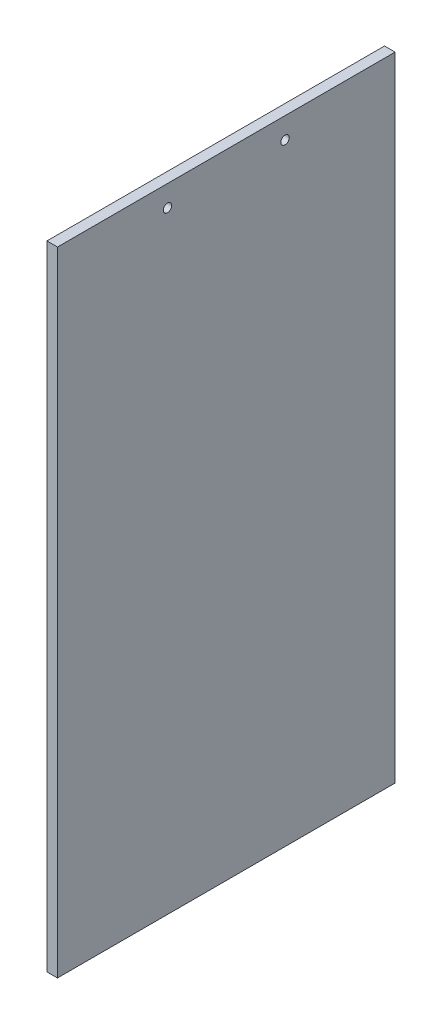
from build123d import *

# Parameters (mm, degrees)
SKETCH_1_W          = 180
SKETCH_1_H          = 300
EXTRUDE_1_DEPTH     = 5
CUT_EXTRUDE_1_REACH = 351.893
SKETCH_2_R          = 2
SKETCH_4_W          = 10
SKETCH_4_H          = 300
CUT_EXTRUDE_3_DEPTH = 10


with BuildPart() as part:
    # 草图1 → 凸台-拉伸1 (new body)
    with BuildSketch(Plane(origin=(0, 0, 0), x_dir=(0, 0, -1), z_dir=(1, 0, 0))):
        with Locations((90, -150)):
            Rectangle(SKETCH_1_W, SKETCH_1_H)
    extrude(amount=EXTRUDE_1_DEPTH)

    # 草图2 → 切除-拉伸1 (cut, up to next)
    with BuildSketch(Plane(origin=(5, 0, 0), x_dir=(0, 0, -1), z_dir=(1, 0, 0)), mode=Mode.PRIVATE) as cut_extrude_1_sk1:
        with Locations((62.15, -10)):
            Circle(SKETCH_2_R)
    cut_extrude_1_tool1 = extrude(cut_extrude_1_sk1.sketch, amount=-CUT_EXTRUDE_1_REACH, mode=Mode.PRIVATE) & part.part
    # 草图2 → 切除-拉伸1 (cut, up to next)
    with BuildSketch(Plane(origin=(5, 0, 0), x_dir=(0, 0, -1), z_dir=(1, 0, 0)), mode=Mode.PRIVATE) as cut_extrude_1_sk2:
        with Locations((117.85, -10)):
            Circle(SKETCH_2_R)
    cut_extrude_1_tool2 = extrude(cut_extrude_1_sk2.sketch, amount=-CUT_EXTRUDE_1_REACH, mode=Mode.PRIVATE) & part.part
    add(cut_extrude_1_tool1.solids().sort_by_distance((5, -10, -62.15))[0], mode=Mode.SUBTRACT)
    add(cut_extrude_1_tool2.solids().sort_by_distance((5, -10, -117.85))[0], mode=Mode.SUBTRACT)

    # 草图4 → 切除-拉伸3 (cut)
    with BuildSketch(Plane(origin=(5, 0, 0), x_dir=(0, 0, -1), z_dir=(1, 0, 0))):
        with Locations((5, -150)):
            Rectangle(SKETCH_4_W, SKETCH_4_H)
        with Locations((175, -150)):
            Rectangle(SKETCH_4_W, SKETCH_4_H)
    extrude(amount=-CUT_EXTRUDE_3_DEPTH, mode=Mode.SUBTRACT)


solid = part.part
